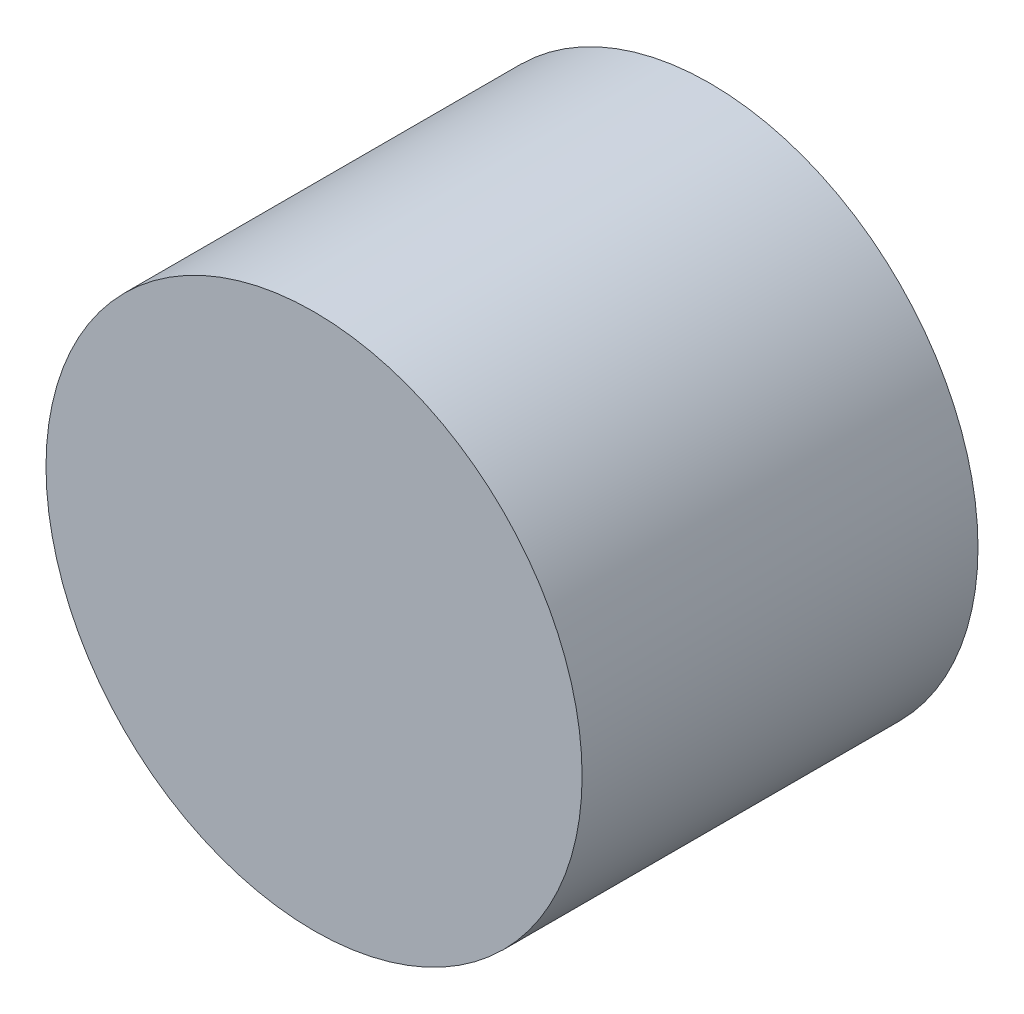
from build123d import *

# Parameters (mm, degrees)
SKETCH1_R           = 103.1875
BOSS_EXTRUDE1_DEPTH = 152.4
SKETCH2_R           = 101.6
CUT_EXTRUDE1_DEPTH  = 149.225
SKETCH3_R           = 5.08
CUT_EXTRUDE2_DEPTH  = 212.000190314


with BuildPart() as part:
    # Sketch1 → Boss-Extrude1 (new body)
    with BuildSketch(Plane.XY):
        with Locations(Location((0, 0, 0), (0, 0, 180))):
            Circle(SKETCH1_R)
    extrude(amount=BOSS_EXTRUDE1_DEPTH)

    # Sketch2 → Cut-Extrude1 (cut)
    with BuildSketch(Plane(origin=(0, 0, 0), x_dir=(-1, 0, 0), z_dir=(0, 0, -1))):
        Circle(SKETCH2_R)
    extrude(amount=-CUT_EXTRUDE1_DEPTH, mode=Mode.SUBTRACT)

    # Sketch3 → Cut-Extrude2 (cut, through all)
    with BuildSketch(Plane(origin=(0, 0, 0), x_dir=(0, 0, -1), z_dir=(1, 0, 0))):
        with Locations((-144.145, 0)):
            Circle(SKETCH3_R)
    extrude(amount=-CUT_EXTRUDE2_DEPTH, mode=Mode.SUBTRACT)


solid = part.part
